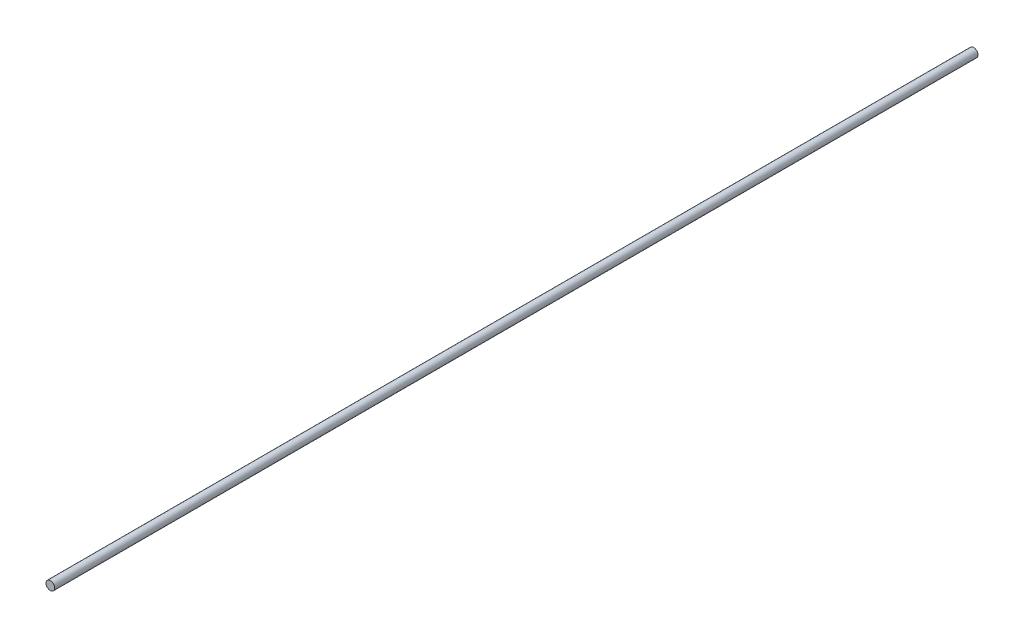
from build123d import *

# Parameters (mm, degrees)
ESQUISSE1_R        = 3
BOSS_EXTRU_1_DEPTH = 640


with BuildPart() as part:
    # Esquisse1 → Boss.-Extru.1 (new body)
    with BuildSketch(Plane.XY):
        Circle(ESQUISSE1_R)
    extrude(amount=BOSS_EXTRU_1_DEPTH)


solid = part.part
